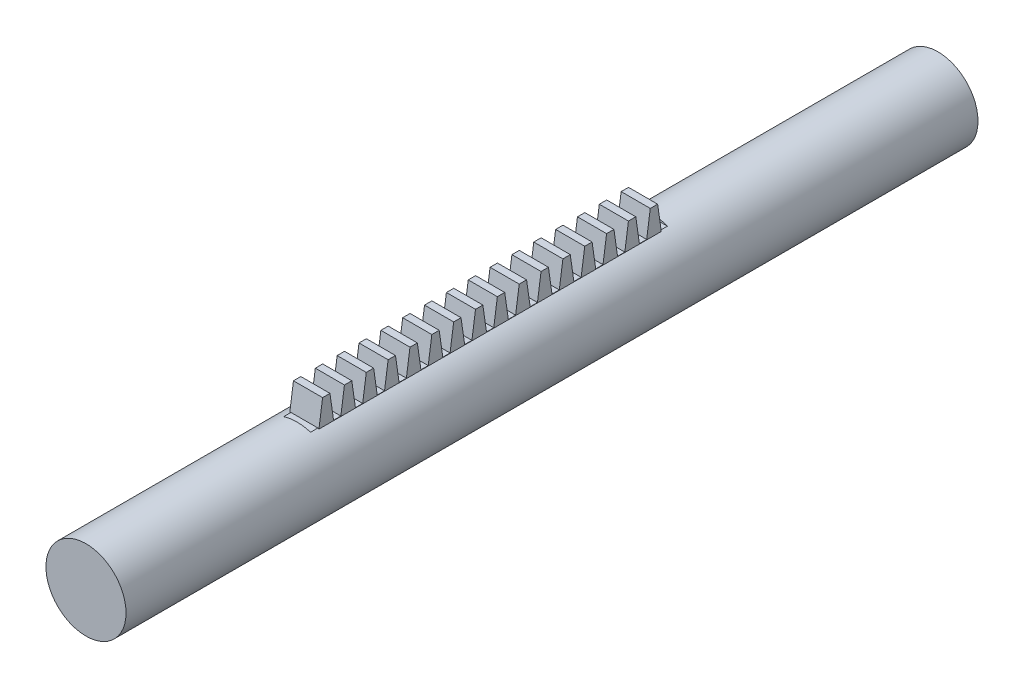
from build123d import *
from build123d.topology import SkipClean

# Parameters (mm, degrees)
SKETCH1_R           = 5.5
BOSS_EXTRUDE3_DEPTH = 117
SKETCH1_3_R         = 4.5
CUT_EXTRUDE4_DEPTH  = 115
BOSS_EXTRUDE4_DEPTH = 87
CUT_EXTRUDE5_DEPTH  = 40
CUT_EXTRUDE6_DEPTH  = 4


with BuildPart() as part:
    # Sketch1 → Boss-Extrude3 (new body)
    with BuildSketch(Plane.XY):
        Circle(SKETCH1_R)
    extrude(amount=BOSS_EXTRUDE3_DEPTH)

    # Sketch1<3> → Cut-Extrude4 (cut)
    with BuildSketch(Plane.XY):
        Circle(SKETCH1_3_R)
    extrude(amount=CUT_EXTRUDE4_DEPTH, mode=Mode.SUBTRACT)

    # Sketch1<4> → Boss-Extrude4 (add)
    with BuildSketch(Plane.XY):
        with BuildLine():
            Line((2, 8.623475383), (-2, 8.623475383))
            Line((-2, 8.623475383), (-2, 5.123475383))
            ThreePointArc((-2, 5.123475383), (0, 5.5), (2, 5.123475383))
            Line((2, 5.123475383), (2, 8.623475383))
        make_face()
    extrude(amount=BOSS_EXTRUDE4_DEPTH)

    # Sketch1<5> → Cut-Extrude5 (cut)
    with SkipClean():  # the faces are left unmerged after this step: merging them gives an invalid solid
        with BuildSketch(Plane.XY):
            with BuildLine():
                Line((2, 8.623475383), (-2, 8.623475383))
                Line((-2, 8.623475383), (-2, 5.123475383))
                ThreePointArc((-2, 5.123475383), (0, 5.5), (2, 5.123475383))
                Line((2, 5.123475383), (2, 8.623475383))
            make_face()
        extrude(amount=CUT_EXTRUDE5_DEPTH, mode=Mode.SUBTRACT)

    # Sketch11 → Cut-Extrude6 (cut)
    with SkipClean():  # the faces are left unmerged after this step: merging them gives an invalid solid
        with BuildSketch(Plane(origin=(2, 0, 0), x_dir=(0, 0, -1), z_dir=(1, 0, 0))):
            Polygon((-62.5, 8.664491245), (-64.5, 8.664491245), (-64, 5.179641377), (-63, 5.179641377), align=None)
            Polygon((-59.5, 8.664491245), (-61.5, 8.664491245), (-61, 5.179641377), (-60, 5.179641377), align=None)
            Polygon((-56.5, 8.664491245), (-58.5, 8.664491245), (-58, 5.179641377), (-57, 5.179641377), align=None)
            Polygon((-53.5, 8.664491245), (-55.5, 8.664491245), (-55, 5.179641377), (-54, 5.179641377), align=None)
            Polygon((-50.5, 8.664491245), (-52.5, 8.664491245), (-52, 5.179641377), (-51, 5.179641377), align=None)
            Polygon((-47.5, 8.664491245), (-49.5, 8.664491245), (-49, 5.179641377), (-48, 5.179641377), align=None)
            Polygon((-44.5, 8.664491245), (-46.5, 8.664491245), (-46, 5.179641377), (-45, 5.179641377), align=None)
            Polygon((-41.5, 8.664491245), (-43.5, 8.664491245), (-43, 5.179641377), (-42, 5.179641377), align=None)
            Polygon((-38.5, 8.664491245), (-40.5, 8.664491245), (-40, 5.179641377), (-39, 5.179641377), align=None)
            Polygon((-65.5, 8.664491245), (-67.5, 8.664491245), (-67, 5.179641377), (-66, 5.179641377), align=None)
            Polygon((-68.5, 8.664491245), (-70.5, 8.664491245), (-70, 5.179641377), (-69, 5.179641377), align=None)
            Polygon((-71.5, 8.664491245), (-73.5, 8.664491245), (-73, 5.179641377), (-72, 5.179641377), align=None)
            Polygon((-74.5, 8.664491245), (-76.5, 8.664491245), (-76, 5.179641377), (-75, 5.179641377), align=None)
            Polygon((-77.5, 8.664491245), (-79.5, 8.664491245), (-79, 5.179641377), (-78, 5.179641377), align=None)
            Polygon((-80.5, 8.664491245), (-82.5, 8.664491245), (-82, 5.179641377), (-81, 5.179641377), align=None)
            Polygon((-83.5, 8.664491245), (-85.5, 8.664491245), (-85, 5.179641377), (-84, 5.179641377), align=None)
            Polygon((-86.5, 8.664491245), (-88.5, 8.664491245), (-88, 5.179641377), (-87, 5.179641377), align=None)
        extrude(amount=-CUT_EXTRUDE6_DEPTH, mode=Mode.SUBTRACT)


solid = part.part
